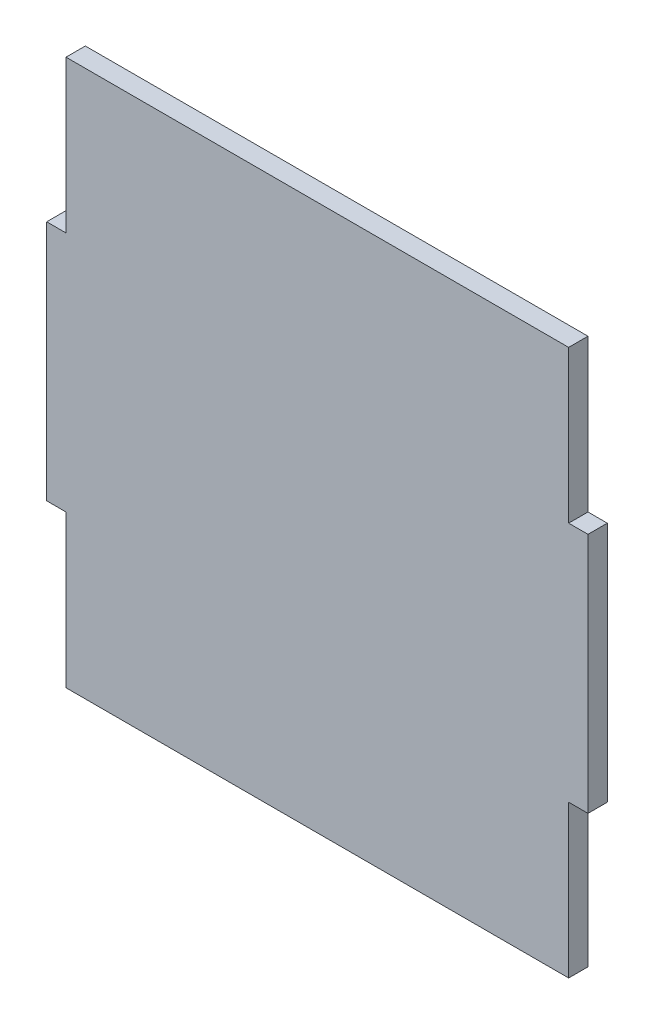
from build123d import *

# Parameters (mm, degrees)
SKETCH_2_W          = 104
SKETCH_2_H          = 163
EXTRUDE_1_DEPTH     = 4
SKETCH_4_W          = 104
SKETCH_4_H          = 29.5
SKETCH_4_H_2        = 20.5
CUT_EXTRUDE_1_DEPTH = 4
SKETCH_5_W          = 4
SKETCH_5_H          = 50
EXTRUDE_2_DEPTH     = 4
SKETCH_7_W          = 4
SKETCH_7_H          = 50
EXTRUDE_3_DEPTH     = 4


with BuildPart() as part:
    # 스케치2 → 보스-돌출1 (new body)
    with BuildSketch(Plane.XY.offset(40)):
        with Locations((-56, 1.5)):
            Rectangle(SKETCH_2_W, SKETCH_2_H)
    extrude(amount=EXTRUDE_1_DEPTH)

    # 스케치4 → 컷-돌출1 (cut)
    with BuildSketch(Plane(origin=(0, 0, 40), x_dir=(-1, 0, 0), z_dir=(0, 0, -1))):
        with Locations((56, 68.25)):
            Rectangle(SKETCH_4_W, SKETCH_4_H)
        with Locations((56, -69.75)):
            Rectangle(SKETCH_4_W, SKETCH_4_H_2)
    extrude(amount=-CUT_EXTRUDE_1_DEPTH, mode=Mode.SUBTRACT)

    # 스케치5 → 보스-돌출2 (add)
    with BuildSketch(Plane.ZY.offset(108)):
        with Locations((42, -3)):
            Rectangle(SKETCH_5_W, SKETCH_5_H)
    extrude(amount=EXTRUDE_2_DEPTH)

    # 스케치7 → 보스-돌출3 (add)
    with BuildSketch(Plane(origin=(-4, 0, 0), x_dir=(0, 0, -1), z_dir=(1, 0, 0))):
        with Locations((-42, -3)):
            Rectangle(SKETCH_7_W, SKETCH_7_H)
    extrude(amount=EXTRUDE_3_DEPTH)


solid = part.part
